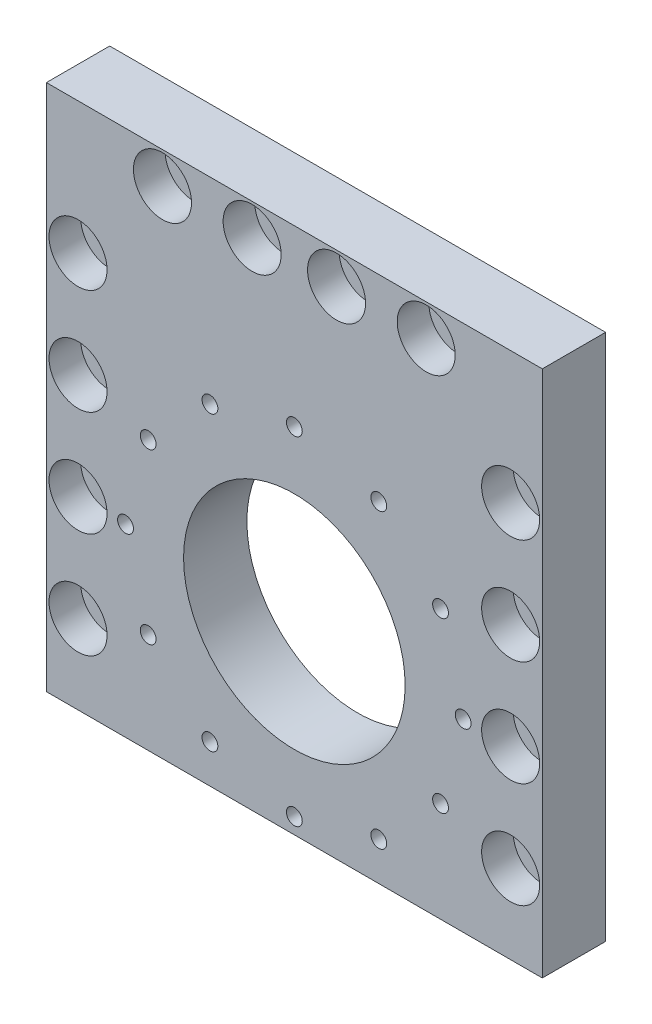
from build123d import *

# Parameters (mm, degrees)
SKETCH_1_W          = 70
SKETCH_1_H          = 70
SKETCH_1_R          = 21
SKETCH_1_R_2        = 1.5
EXTRUDE_1_DEPTH     = 12
SKETCH_3_W          = 70
SKETCH_3_H          = 12
EXTRUDE_2_DEPTH     = 30
SKETCH_4_R          = 3
CUT_EXTRUDE_2_DEPTH = 12
SKETCH_7_R          = 5.5
CUT_EXTRUDE_6_DEPTH = 6
SKETCH_8_W          = 12
SKETCH_8_H          = 100
EXTRUDE_3_DEPTH     = 12
SKETCH_11_W         = 12
SKETCH_11_H         = 100
EXTRUDE_4_DEPTH     = 12
SKETCH_12_R         = 3
CUT_EXTRUDE_7_DEPTH = 22
SKETCH_13_R         = 5.5
CUT_EXTRUDE_8_DEPTH = 6
SKETCH_14_R         = 3
CUT_EXTRUDE_9_DEPTH = 10


with BuildPart() as part:
    # 草图1 → 凸台-拉伸1 (new body)
    with BuildSketch(Plane.XY):
        Rectangle(SKETCH_1_W, SKETCH_1_H)
        Circle(SKETCH_1_R, mode=Mode.SUBTRACT)
        with Locations((32, 0)):
            Circle(SKETCH_1_R_2, mode=Mode.SUBTRACT)
        with Locations((27.712812921, -16)):
            Circle(SKETCH_1_R_2, mode=Mode.SUBTRACT)
        with Locations((16, -27.712812921)):
            Circle(SKETCH_1_R_2, mode=Mode.SUBTRACT)
        with Locations((0, -32)):
            Circle(SKETCH_1_R_2, mode=Mode.SUBTRACT)
        with Locations((-16, -27.712812921)):
            Circle(SKETCH_1_R_2, mode=Mode.SUBTRACT)
        with Locations((-27.712812921, -16)):
            Circle(SKETCH_1_R_2, mode=Mode.SUBTRACT)
        with Locations((-32, 0)):
            Circle(SKETCH_1_R_2, mode=Mode.SUBTRACT)
        with Locations((-27.712812921, 16)):
            Circle(SKETCH_1_R_2, mode=Mode.SUBTRACT)
        with Locations((-16, 27.712812921)):
            Circle(SKETCH_1_R_2, mode=Mode.SUBTRACT)
        with Locations((0, 32)):
            Circle(SKETCH_1_R_2, mode=Mode.SUBTRACT)
        with Locations((16, 27.712812921)):
            Circle(SKETCH_1_R_2, mode=Mode.SUBTRACT)
        with Locations((27.712812921, 16)):
            Circle(SKETCH_1_R_2, mode=Mode.SUBTRACT)
    extrude(amount=EXTRUDE_1_DEPTH)

    # 草图3 → 凸台-拉伸2 (add)
    with BuildSketch(Plane(origin=(0, 35, 0), x_dir=(1, 0, 0), z_dir=(0, 1, 0))):
        with Locations((0, -6)):
            Rectangle(SKETCH_3_W, SKETCH_3_H)
    extrude(amount=EXTRUDE_2_DEPTH)

    # 草图4 → 切除-拉伸2 (cut)
    with BuildSketch(Plane(origin=(0, 0, 0), x_dir=(-1, 0, 0), z_dir=(0, 0, -1))):
        with Locations((-25, 59)):
            Circle(SKETCH_4_R)
        with Locations((-8, 59)):
            Circle(SKETCH_4_R)
        with Locations(Location((25, 59, 0), (0, 0, 180))):
            Circle(SKETCH_4_R)
        with Locations(Location((8, 59, 0), (0, 0, 180))):
            Circle(SKETCH_4_R)
    extrude(amount=-CUT_EXTRUDE_2_DEPTH, mode=Mode.SUBTRACT)

    # 草图7 → 切除-拉伸6 (cut)
    with BuildSketch(Plane.XY.offset(12)):
        with Locations((-25, 59)):
            Circle(SKETCH_7_R)
        with Locations((-8, 59)):
            Circle(SKETCH_7_R)
        with Locations((8, 59)):
            Circle(SKETCH_7_R)
        with Locations((25, 59)):
            Circle(SKETCH_7_R)
    extrude(amount=-CUT_EXTRUDE_6_DEPTH, mode=Mode.SUBTRACT)

    # 草图8 → 凸台-拉伸3 (add)
    with BuildSketch(Plane(origin=(35, 0, 0), x_dir=(0, 0, -1), z_dir=(1, 0, 0))):
        with Locations((-6, 15)):
            Rectangle(SKETCH_8_W, SKETCH_8_H)
    extrude(amount=EXTRUDE_3_DEPTH)

    # 草图11 → 凸台-拉伸4 (add)
    with BuildSketch(Plane.ZY.offset(35)):
        with Locations((6, 15)):
            Rectangle(SKETCH_11_W, SKETCH_11_H)
    extrude(amount=EXTRUDE_4_DEPTH)

    # 草图12 → 切除-拉伸7 (cut)
    with BuildSketch(Plane.XY.offset(12)):
        with Locations((41, -20)):
            Circle(SKETCH_12_R)
        with Locations((41, 0)):
            Circle(SKETCH_12_R)
        with Locations((41, 20)):
            Circle(SKETCH_12_R)
        with Locations((41, 40)):
            Circle(SKETCH_12_R)
        with Locations((-41, -20)):
            Circle(SKETCH_12_R)
        with Locations((-41, 0)):
            Circle(SKETCH_12_R)
        with Locations((-41, 40)):
            Circle(SKETCH_12_R)
        with Locations((-41, 20)):
            Circle(SKETCH_12_R)
    extrude(amount=-CUT_EXTRUDE_7_DEPTH, mode=Mode.SUBTRACT)

    # 草图13 → 切除-拉伸8 (cut)
    with BuildSketch(Plane.XY.offset(12)):
        with Locations((41, 40)):
            Circle(SKETCH_13_R)
        with Locations((41, 20)):
            Circle(SKETCH_13_R)
        with Locations((41, 0)):
            Circle(SKETCH_13_R)
        with Locations(Location((-41, -20, 0), (0, 0, 180))):
            Circle(SKETCH_13_R)
        with Locations((41, -20)):
            Circle(SKETCH_13_R)
        with Locations(Location((-41, 0, 0), (0, 0, 180))):
            Circle(SKETCH_13_R)
        with Locations(Location((-41, 20, 0), (0, 0, 180))):
            Circle(SKETCH_13_R)
        with Locations(Location((-41, 40, 0), (0, 0, 180))):
            Circle(SKETCH_13_R)
    extrude(amount=-CUT_EXTRUDE_8_DEPTH, mode=Mode.SUBTRACT)

    # 草图14 → 切除-拉伸9 (cut)
    with BuildSketch(Plane.XZ.offset(35)):
        with Locations(Location((-33, 6, 0), (0, 0, 270))):
            Circle(SKETCH_14_R)
        with Locations(Location((-8, 6, 0), (0, 0, 270))):
            Circle(SKETCH_14_R)
        with Locations(Location((33, 6, 0), (0, 0, 90))):
            Circle(SKETCH_14_R)
        with Locations(Location((8, 6, 0), (0, 0, 90))):
            Circle(SKETCH_14_R)
    extrude(amount=-CUT_EXTRUDE_9_DEPTH, mode=Mode.SUBTRACT)


solid = part.part
